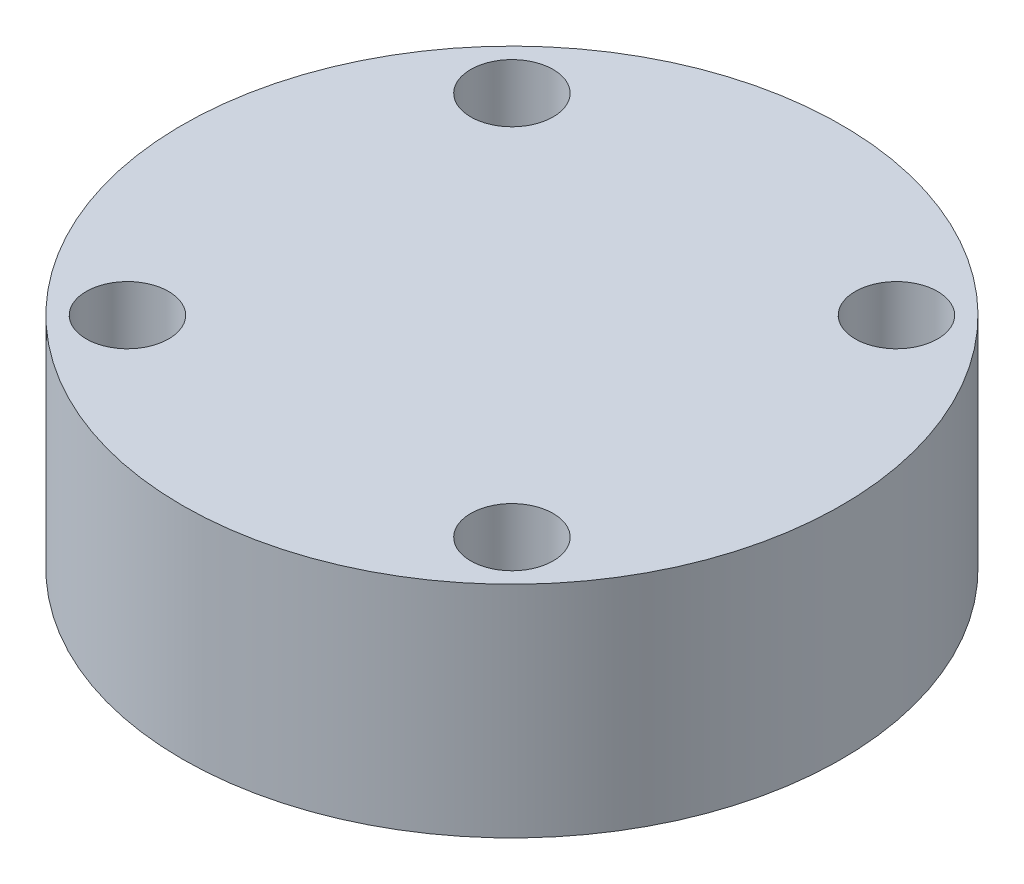
from build123d import *

# Parameters (mm, degrees)
SKETCH1_R           = 9.525
SKETCH1_R_2         = 1.190625
BOSS_EXTRUDE1_DEPTH = 6.35


with BuildPart() as part:
    # Sketch1 → Boss-Extrude1 (new body)
    with BuildSketch(Plane(origin=(0, 0, 0), x_dir=(1, 0, 0), z_dir=(0, 1, 0))):
        with Locations(Location((0, 0, 0), (0, 0, 270))):
            Circle(SKETCH1_R)
        with Locations(Location((5.55625, 5.55625, 0), (0, 0, 270))):
            Circle(SKETCH1_R_2, mode=Mode.SUBTRACT)
        with Locations(Location((5.55625, -5.55625, 0), (0, 0, 90))):
            Circle(SKETCH1_R_2, mode=Mode.SUBTRACT)
        with Locations(Location((-5.55625, -5.55625, 0), (0, 0, 270))):
            Circle(SKETCH1_R_2, mode=Mode.SUBTRACT)
        with Locations(Location((-5.55625, 5.55625, 0), (0, 0, 90))):
            Circle(SKETCH1_R_2, mode=Mode.SUBTRACT)
    extrude(amount=BOSS_EXTRUDE1_DEPTH)


solid = part.part
